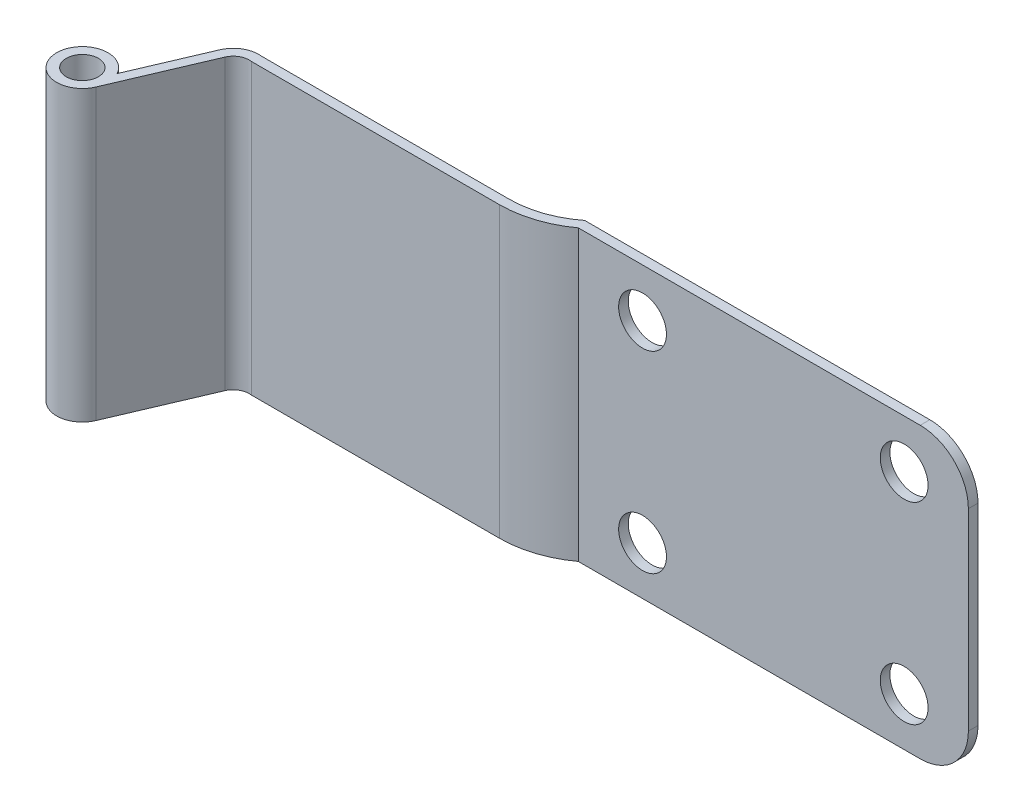
from build123d import *

# Parameters (mm, degrees)
SKETCH7_R           = 5
BOSS_EXTRUDE1_DEPTH = 90
SKETCH8_R           = 7.447394551
CUT_EXTRUDE1_DEPTH  = 90
FILLET1_R           = 15


with BuildPart() as part:
    # Sketch7 → Boss-Extrude1 (new body)
    with BuildSketch(Plane(origin=(0, 0, 0), x_dir=(1, 0, 0), z_dir=(0, 1, 0))):
        with BuildLine():
            Line((7.357897338, -3.140278136), (19.375959063, 25.018904128))
            ThreePointArc((19.375959063, 25.018904128), (21.522528234, 27.403649264), (24.679857301, 27.974649904))
            Line((24.679857301, 27.974649904), (102, 27.974649904))
            ThreePointArc((102, 27.974649904), (111.729786481, 29.518933772), (120.503246637, 34))
            Line((120.503246637, 34), (242, 34))
            Line((242, 34), (242, 37))
            Line((242, 37), (119.499086706, 37))
            ThreePointArc((119.499086706, 37), (111.253686824, 32.523169315), (102, 30.974649904))
            Line((102, 30.974649904), (24.879394183, 30.974649904))
            ThreePointArc((24.879394183, 30.974649904), (19.95222913, 29.961796073), (16.616747562, 26.196508428))
            Line((16.616747562, 26.196508428), (7.05006467, 3.781082934))
            ThreePointArc((7.05006467, 3.781082934), (-7.992099353, -0.355454547), (7.357897338, -3.140278136))
        make_face()
        with Locations(Location((0, 0, 0), (0, 0, 90))):
            Circle(SKETCH7_R, mode=Mode.SUBTRACT)
    extrude(amount=BOSS_EXTRUDE1_DEPTH)

    # Sketch8 → Cut-Extrude1 (cut)
    with BuildSketch(Plane.XY.offset(-34)):
        with Locations((140.503246637, 75)):
            Circle(SKETCH8_R)
        with Locations((140.503246637, 15)):
            Circle(SKETCH8_R)
        with Locations((222, 75)):
            Circle(SKETCH8_R)
        with Locations((222, 15)):
            Circle(SKETCH8_R)
    extrude(amount=-CUT_EXTRUDE1_DEPTH, mode=Mode.SUBTRACT)

    # Fillet1
    fillet1_edges = [part.edges().sort_by_distance(p)[0] for p in [
        (242, 0, -35.5),
        (242, 90, -35.5),
    ]]
    fillet(fillet1_edges, radius=FILLET1_R)


solid = part.part
